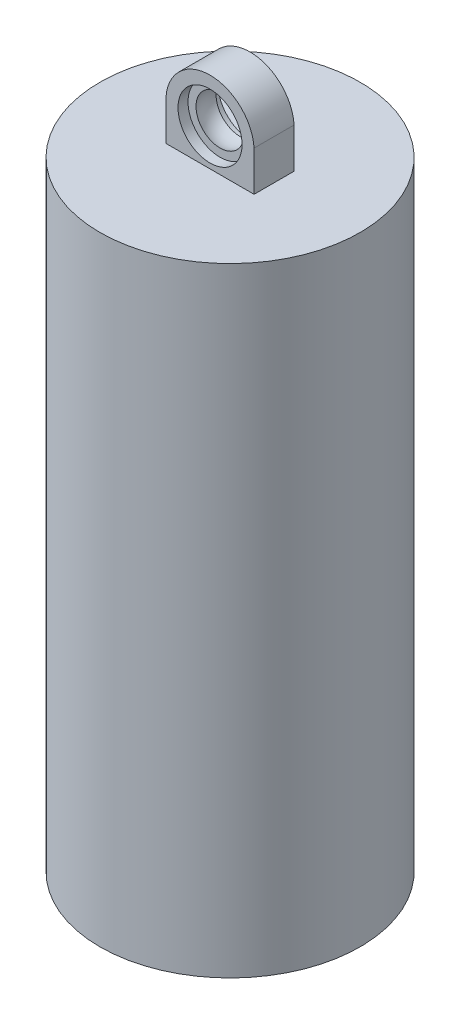
from build123d import *

# Parameters (mm, degrees)
SKETCH_1_R          = 32.5
EXTRUDE_1_DEPTH     = 154.5
SKETCH_2_R          = 12.5
EXTRUDE_2_DEPTH     = 6
SKETCH_3_R          = 6
CUT_EXTRUDE_1_DEPTH = 80
SKETCH_4_R          = 8
EXTRUDE_3_DEPTH     = 5
SKETCH_5_R          = 8
EXTRUDE_4_DEPTH     = 2.5
SKETCH_8_R          = 4
SKETCH_7_R          = 6
SKETCH_9_R          = 2.5
CUT_EXTRUDE_2_DEPTH = 31
SKETCH_10_R         = 6
CUT_EXTRUDE_3_DEPTH = 17


with BuildPart() as part:
    # 草图1 → 凸台-拉伸1 (new body)
    with BuildSketch(Plane(origin=(0, 0, 0), x_dir=(1, 0, 0), z_dir=(0, 1, 0))):
        with Locations(Location((0, 0, 0), (0, 0, 270))):
            Circle(SKETCH_1_R)
    extrude(amount=EXTRUDE_1_DEPTH)

    # 草图2 → 凸台-拉伸2 (add)
    with BuildSketch(Plane.XZ):
        with Locations(Location((0, 0, 0), (0, 0, 270))):
            Circle(SKETCH_2_R)
    extrude(amount=EXTRUDE_2_DEPTH)

    # 草图3 → 切除-拉伸1 (cut)
    with BuildSketch(Plane.XZ.offset(6)):
        with Locations(Location((0, 0, 0), (0, 0, 270))):
            Circle(SKETCH_3_R)
    extrude(amount=-CUT_EXTRUDE_1_DEPTH, mode=Mode.SUBTRACT)

    # 草图4 → 凸台-拉伸3 (add, symmetric)
    with BuildSketch(Plane.XY):
        with BuildLine():
            Line((-11, 154.5), (11, 154.5))
            Line((11, 154.5), (11, 164.5))
            ThreePointArc((11, 164.5), (0, 174.786108986), (-11, 164.5))
            Line((-11, 164.5), (-11, 154.5))
        make_face()
        with Locations((0, 163.761335751)):
            Circle(SKETCH_4_R, mode=Mode.SUBTRACT)
    extrude(amount=EXTRUDE_3_DEPTH, both=True)

    # 草图5 → 凸台-拉伸4 (add, symmetric)
    with BuildSketch(Plane.XY):
        with Locations((0, 163.761335751)):
            Circle(SKETCH_5_R)
    extrude(amount=EXTRUDE_4_DEPTH, both=True)

    # 草图8 → 放样1 section 0
    with BuildSketch(Plane.XY.offset(4.5)):
        with Locations((0, 163.761335751)):
            Circle(SKETCH_8_R)
    # 草图7 → 放样1 section 1
    with BuildSketch(Plane.XY.offset(2.5)):
        with Locations((0, 163.761335751)):
            Circle(SKETCH_7_R)
    loft_1 = loft()

    # 镜向1: 放样1 across plane
    add(loft_1.mirror(Plane.XY))

    # 草图9 → 切除-拉伸2 (cut)
    with BuildSketch(Plane.XY.offset(4.5)):
        with Locations(Location((0, 166.761335751, 0), (0, 0, 2.865983983))):
            Circle(SKETCH_9_R)
    extrude(amount=-CUT_EXTRUDE_2_DEPTH, mode=Mode.SUBTRACT)

    # 草图10 → 切除-拉伸3 (cut)
    with BuildSketch(Plane.XY.offset(4.5)):
        with Locations((0, 163.761335751)):
            Circle(SKETCH_10_R)
    extrude(amount=-CUT_EXTRUDE_3_DEPTH, mode=Mode.SUBTRACT)

    # 草图11 → 切除-旋转1 (revolve, cut)
    with BuildSketch(Plane.XY):
        with BuildLine():
            Line((0, 170.261335751), (0, 157.261335751))
            ThreePointArc((0, 157.261335751), (6.5, 163.761335751), (0, 170.261335751))
        make_face()
    revolve(axis=Axis((0, 170.261335751, 0), (0, -1, 0)), mode=Mode.SUBTRACT)


solid = part.part
